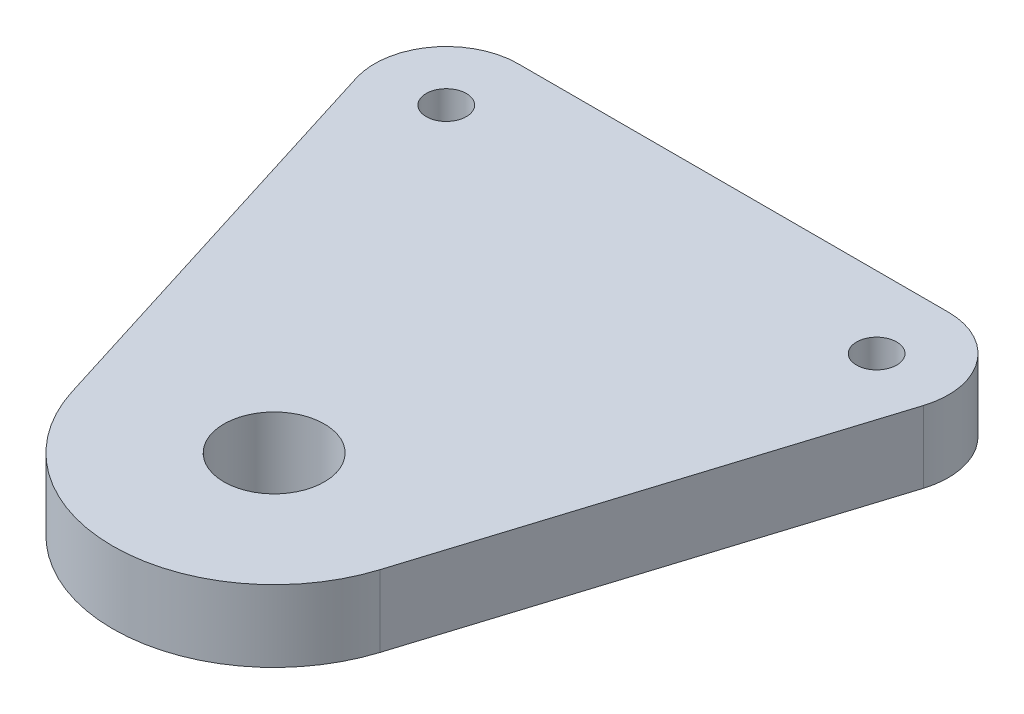
from build123d import *

# Parameters (mm, degrees)
SKETCH1_R           = 3.5
SKETCH1_R_2         = 1.4
BOSS_EXTRUDE1_DEPTH = 5


with BuildPart() as part:
    # Sketch1 → Boss-Extrude1 (new body)
    with BuildSketch(Plane(origin=(0, 0, 0), x_dir=(1, 0, 0), z_dir=(0, 1, 0))):
        with BuildLine():
            Line((-15, 32), (15, 32))
            ThreePointArc((15, 32), (19.029127777, 29.960764996), (19.771720194, 25.506451744))
            Line((19.771720194, 25.506451744), (10.736370436, -3.360483576))
            ThreePointArc((10.736370436, -3.360483576), (0, -11.25), (-10.736370436, -3.360483576))
            Line((-10.736370436, -3.360483576), (-19.771720194, 25.506451744))
            ThreePointArc((-19.771720194, 25.506451744), (-19.029127777, 29.960764996), (-15, 32))
        make_face()
        with Locations(Location((0, 0, 0), (0, 0, 270))):
            Circle(SKETCH1_R, mode=Mode.SUBTRACT)
        with Locations(Location((-15, 27, 0), (0, 0, 270))):
            Circle(SKETCH1_R_2, mode=Mode.SUBTRACT)
        with Locations(Location((15, 27, 0), (0, 0, 270))):
            Circle(SKETCH1_R_2, mode=Mode.SUBTRACT)
    extrude(amount=BOSS_EXTRUDE1_DEPTH)


solid = part.part
